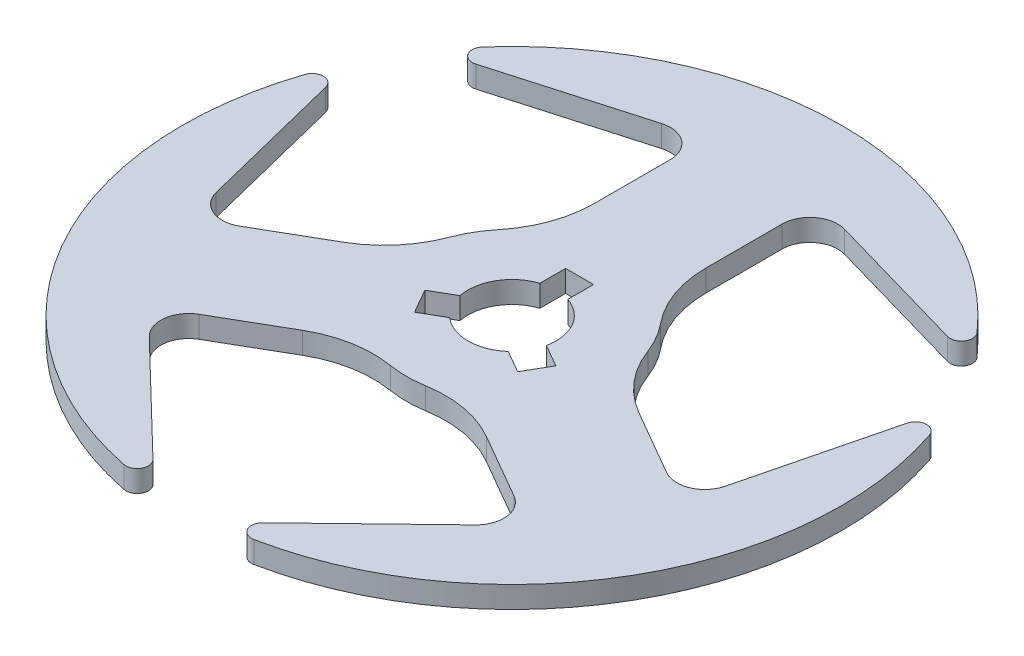
from build123d import *

# Parameters (mm, degrees)
SKETCH1_R           = 2.4003
BOSS_EXTRUDE1_DEPTH = 0.493268
CIRPATTERN1_COUNT   = 3
SKETCH2_R           = 1.0033
CUT_EXTRUDE3_DEPTH  = 11.608176626
CIRPATTERN2_COUNT   = 3
FILLET1_R           = 2.54


with BuildPart() as part:
    # Sketch1 → Boss-Extrude1 (new body)
    with BuildSketch(Plane(origin=(0, 0, 0), x_dir=(1, 0, 0), z_dir=(0, 1, 0))):
        with BuildLine():
            ThreePointArc((-2.080029721, 5.48099038), (-1.52284746, 5.377722752), (-1.27, 4.870589203))
            Line((-1.27, 4.870589203), (-1.27, 2.036796526))
            ThreePointArc((-1.27, 2.036796526), (0, 2.4003), (1.27, 2.036796526))
            Line((1.27, 2.036796526), (1.27, 4.870589203))
            ThreePointArc((1.27, 4.870589203), (1.52284746, 5.377722752), (2.080029721, 5.48099038))
            Line((2.080029721, 5.48099038), (5.363123917, 4.539578268))
            ThreePointArc((5.363123917, 4.539578268), (5.647788598, 4.647944118), (5.62377215, 4.951589221))
            ThreePointArc((5.62377215, 4.951589221), (0, 7.493), (-5.62377215, 4.951589221))
            ThreePointArc((-5.62377215, 4.951589221), (-5.647788598, 4.647944118), (-5.363123917, 4.539578268))
            Line((-5.363123917, 4.539578268), (-2.080029721, 5.48099038))
        make_face()
        Circle(SKETCH1_R)
    boss_extrude1 = extrude(amount=BOSS_EXTRUDE1_DEPTH)

    # CirPattern1: Boss-Extrude1 ×3 about axis
    cirpattern1_axis = Axis((0, 0, 0), (0, 1, 0))
    for i in range(1, CIRPATTERN1_COUNT):
        add(boss_extrude1.rotate(cirpattern1_axis, i * 360 / CIRPATTERN1_COUNT))

    # Sketch2 → Cut-Extrude3 (cut, through all)
    with BuildSketch(Plane(origin=(0, 0.493268, 0), x_dir=(1, 0, 0), z_dir=(0, 1, 0))):
        Circle(SKETCH2_R)
        with BuildLine():
            Line((0.3175, 0.951737695), (0.3175, 1.5367))
            Line((0.3175, 1.5367), (-0.3175, 1.5367))
            Line((-0.3175, 1.5367), (-0.3175, 0.951737695))
            ThreePointArc((-0.3175, 0.951737695), (0, 1.0033), (0.3175, 0.951737695))
        make_face()
    cut_extrude3 = extrude(amount=-CUT_EXTRUDE3_DEPTH, mode=Mode.SUBTRACT)

    # CirPattern2: Cut-Extrude3 ×3 about axis
    cirpattern2_axis = Axis((0, 0, 0), (0, 1, 0))
    for i in range(1, CIRPATTERN2_COUNT):
        add(cut_extrude3.rotate(cirpattern2_axis, i * 360 / CIRPATTERN2_COUNT), mode=Mode.SUBTRACT)

    # Fillet1
    fillet1_edges = [part.edges().sort_by_distance(p)[0] for p in [
        (1.27, 0.246634, -2.036796526),
        (-1.27, 0.246634, -2.036796526),
        (2.398917534, 0.246634, -0.081454),
        (-1.128917534, 0.246634, 2.118250526),
        (-2.398917534, 0.246634, -0.081454),
        (1.128917534, 0.246634, 2.118250526),
    ]]
    fillet(fillet1_edges, radius=FILLET1_R)


solid = part.part
